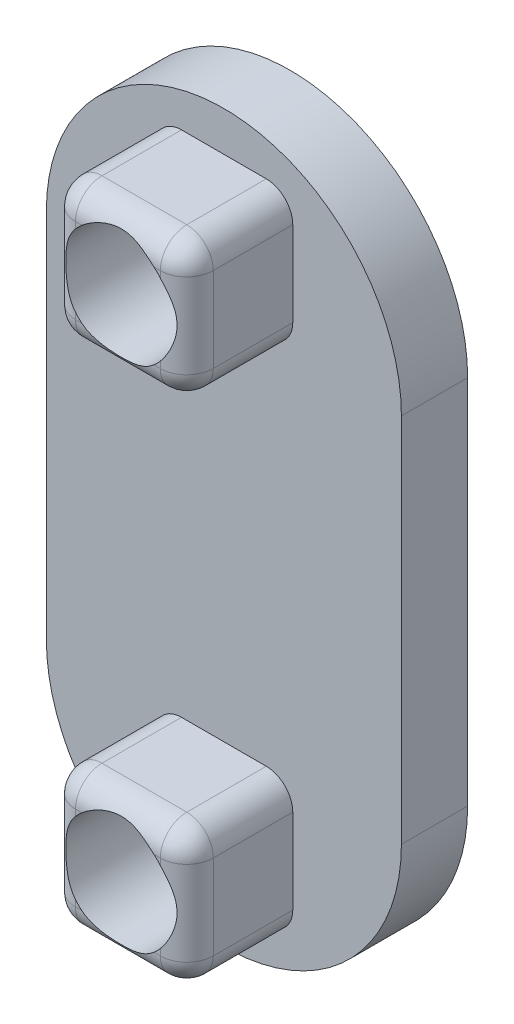
from build123d import *

# Parameters (mm, degrees)
BOSS_EXTRUDE1_DEPTH = 2.5
SKETCH2_W           = 5.2
SKETCH2_H           = 5.2
BOSS_EXTRUDE2_DEPTH = 4
FILLET1_R           = 1
SKETCH3_R           = 2.1
CUT_EXTRUDE1_DEPTH  = 23.707487752


with BuildPart() as part:
    # Sketch1 → Boss-Extrude1 (new body)
    with BuildSketch(Plane(origin=(0, 0, 0), x_dir=(0, 1, 0), z_dir=(0, 0, 1))):
        with BuildLine():
            Line((0, 6.7), (14, 6.7))
            ThreePointArc((14, 6.7), (20.7, 0), (14, -6.7))
            Line((14, -6.7), (0, -6.7))
            ThreePointArc((0, -6.7), (-6.7, 0), (0, 6.7))
        make_face()
    extrude(amount=BOSS_EXTRUDE1_DEPTH)

    # Sketch2 → Boss-Extrude2 (add)
    with BuildSketch(Plane.XY.offset(2.5)):
        with Locations((0, -2.6)):
            Rectangle(SKETCH2_W, SKETCH2_H)
        with Locations((0, 16.6)):
            Rectangle(SKETCH2_W, SKETCH2_H)
    extrude(amount=BOSS_EXTRUDE2_DEPTH)

    # Fillet1
    fillet1_edges = [part.edges().sort_by_distance(p)[0] for p in [
        (-2.6, 0, 4.5),
        (-2.6, -5.2, 4.5),
        (2.6, -5.2, 4.5),
        (2.6, 0, 4.5),
        (-2.6, -2.6, 6.5),
        (0, -5.2, 6.5),
        (2.6, -2.6, 6.5),
        (0, 0, 6.5),
        (-2.6, 14, 4.5),
        (2.6, 14, 4.5),
        (2.6, 19.2, 4.5),
        (-2.6, 19.2, 4.5),
        (0, 14, 6.5),
        (2.6, 16.6, 6.5),
        (0, 19.2, 6.5),
        (-2.6, 16.6, 6.5),
    ]]
    fillet(fillet1_edges, radius=FILLET1_R)

    # Sketch3 → Cut-Extrude1 (cut, through all)
    with BuildSketch(Plane.XY.offset(6.5)):
        with Locations((0, 16.6)):
            Circle(SKETCH3_R)
        with Locations(Location((0, -2.6, 0), (0, 0, 319.632406456))):
            Circle(SKETCH3_R)
    extrude(amount=-CUT_EXTRUDE1_DEPTH, mode=Mode.SUBTRACT)


solid = part.part
